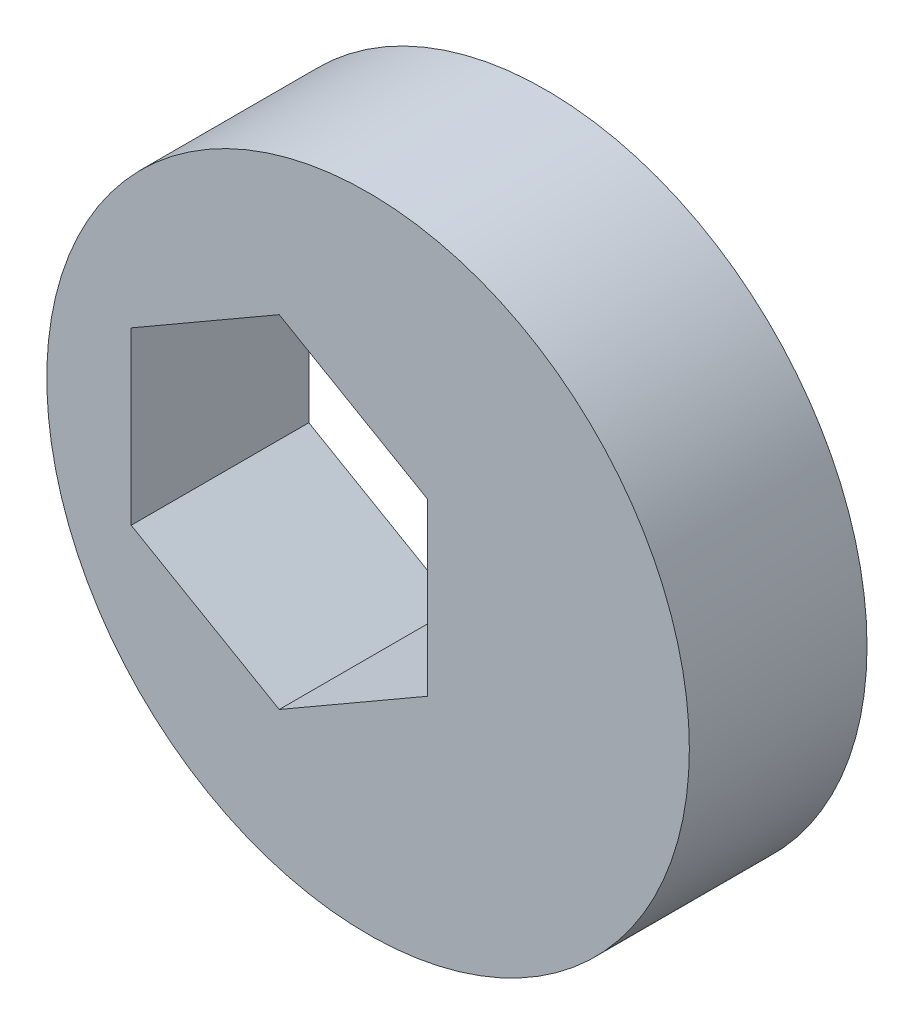
from build123d import *

# Parameters (mm, degrees)
SKETCH1_R           = 10.85
BOSS_EXTRUDE1_DEPTH = 6
SCALE1_SCALE        = 0.4


with BuildPart() as part:
    # Sketch1 → Boss-Extrude1 (new body)
    with BuildSketch(Plane.XY):
        with Locations((3, 0)):
            Circle(SKETCH1_R)
        Polygon((0, 5.773502692), (-5, 2.886751346), (-5, -2.886751346), (0, -5.773502692), (5, -2.886751346), (5, 2.886751346), align=None, mode=Mode.SUBTRACT)
    extrude(amount=-BOSS_EXTRUDE1_DEPTH)


with BuildPart() as part_1:
    # Scale1: scaled about (3.917290958, 0, -3)
    add(part.part.scale(SCALE1_SCALE).moved(Location((2.350374575, 0, -1.8))))


solid = part_1.part
